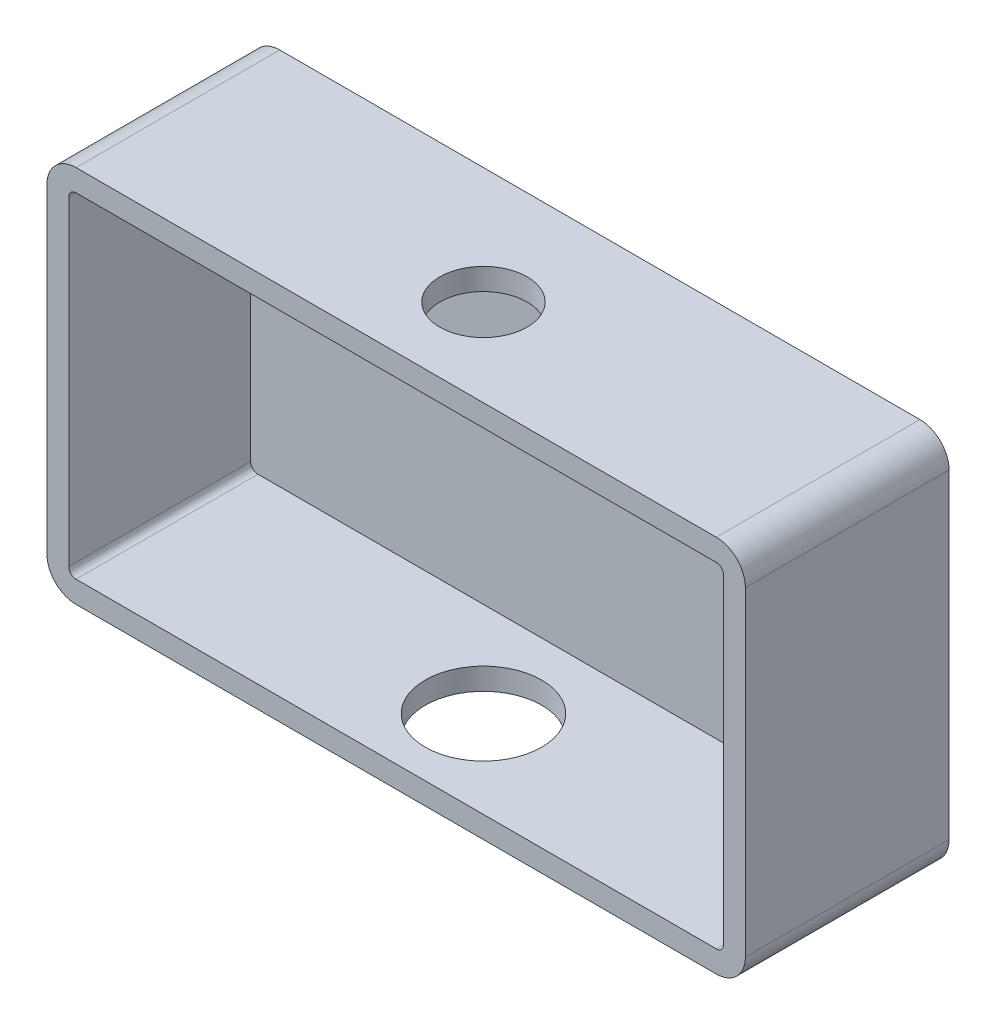
from build123d import *

# Parameters (mm, degrees)
SKETCH_1_W               = 48
SKETCH_1_H               = 26
ENCLOSURE_DEPTH          = 14
FILLET_2_R               = 2
SHELL_1_T                = -1.5
SKETCH_2_R               = 3
CABLE_ENTRY_DEPTH        = 57.356011214
SKETCH_3_R               = 4
CABLE_ENTRY_RELIEF_DEPTH = 1.6


with BuildPart() as part:
    # 草图1 → Enclosure (new body)
    with BuildSketch(Plane.XY):
        with Locations((24, 13)):
            Rectangle(SKETCH_1_W, SKETCH_1_H)
    extrude(amount=ENCLOSURE_DEPTH)

    # Fillet 2
    fillet_2_edges = [part.edges().sort_by_distance(p)[0] for p in [
        (0, 26, 7),
        (48, 26, 7),
        (48, 0, 7),
        (0, 0, 7),
    ]]
    fillet(fillet_2_edges, radius=FILLET_2_R)

    # 抽壳1
    shell_1_openings = [part.faces().sort_by_distance(p)[0] for p in [
        (24, 13, 14),
    ]]
    offset(amount=SHELL_1_T, openings=shell_1_openings, kind=Kind.INTERSECTION)

    # 草图2 → Cable_entry (cut, through all)
    with BuildSketch(Plane.XZ):
        with Locations(Location((24, 8, 0), (0, 0, 270))):
            Circle(SKETCH_2_R)
    extrude(amount=-CABLE_ENTRY_DEPTH, mode=Mode.SUBTRACT)

    # 草图3 → Cable_entry_relief (cut)
    with BuildSketch(Plane.XZ):
        with Locations(Location((24, 8, 0), (0, 0, 270))):
            Circle(SKETCH_3_R)
    extrude(amount=-CABLE_ENTRY_RELIEF_DEPTH, mode=Mode.SUBTRACT)


solid = part.part
